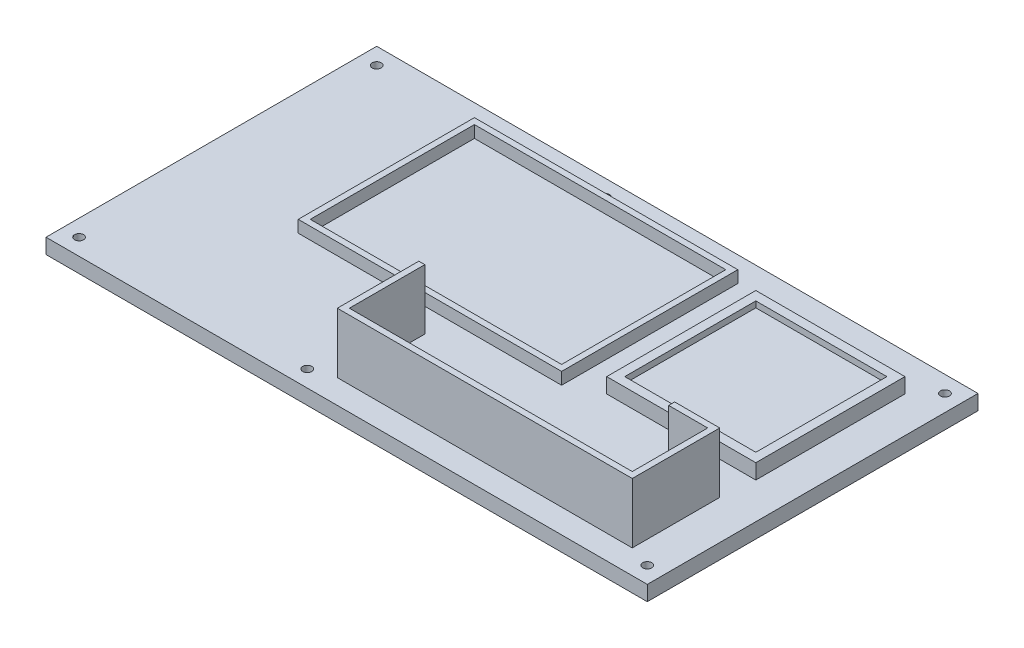
from build123d import *

# Parameters (mm, degrees)
SKETCH1_W           = 200
SKETCH1_H           = 110
BOSS_EXTRUDE1_DEPTH = 5
SKETCH4_R           = 1.5
CUT_EXTRUDE1_DEPTH  = 10
BOSS_EXTRUDE2_DEPTH = 20
SKETCH7_W           = 43.6
SKETCH7_H           = 43.6
BOSS_EXTRUDE3_DEPTH = 3
SKETCH7_3_W         = 49.6
SKETCH7_3_H         = 49.6
SKETCH7_3_W_2       = 43.6
SKETCH7_3_H_2       = 43.6
BOSS_EXTRUDE4_DEPTH = 5
SKETCH8_W           = 87.6
SKETCH8_H           = 58.6
SKETCH8_W_2         = 83.6
SKETCH8_H_2         = 54.6
BOSS_EXTRUDE5_DEPTH = 4
SKETCH9_R           = 1.5
CUT_EXTRUDE2_DEPTH  = 5


with BuildPart() as part:
    # Sketch1 → Boss-Extrude1 (new body)
    with BuildSketch(Plane(origin=(0, 0, 0), x_dir=(1, 0, 0), z_dir=(0, 1, 0))):
        Rectangle(SKETCH1_W, SKETCH1_H)
    extrude(amount=BOSS_EXTRUDE1_DEPTH)

    # Sketch4 → Cut-Extrude1 (cut)
    with BuildSketch(Plane(origin=(0, 5, 0), x_dir=(1, 0, 0), z_dir=(0, 1, 0))):
        with Locations((94.5, 49.5)):
            Circle(SKETCH4_R)
        with Locations((-94.5, 49.5)):
            Circle(SKETCH4_R)
        with Locations((-94.5, -49.5)):
            Circle(SKETCH4_R)
        with Locations((94.5, -49.5)):
            Circle(SKETCH4_R)
    extrude(amount=-CUT_EXTRUDE1_DEPTH, mode=Mode.SUBTRACT)

    # Sketch5 → Boss-Extrude2 (add)
    with BuildSketch(Plane(origin=(0, 5, 0), x_dir=(1, 0, 0), z_dir=(0, 1, 0))):
        Polygon((85, -19.9), (85, -45), (-9.1, -45), (-9.1, -19.9), (-11.1, -19.9), (-11.1, -47), (87, -47), (87, -17.9), (72, -17.9), (72, -19.9), align=None)
    extrude(amount=BOSS_EXTRUDE2_DEPTH)

    # Sketch7 → Boss-Extrude3 (add)
    with BuildSketch(Plane(origin=(0, 5, 0), x_dir=(1, 0, 0), z_dir=(0, 1, 0))):
        with Locations((63.2, 17.9)):
            Rectangle(SKETCH7_W, SKETCH7_H)
    extrude(amount=BOSS_EXTRUDE3_DEPTH)

    # Sketch7<3> → Boss-Extrude4 (add)
    with BuildSketch(Plane(origin=(0, 5, 0), x_dir=(1, 0, 0), z_dir=(0, 1, 0))):
        with Locations((63.2, 17.9)):
            Rectangle(SKETCH7_3_W, SKETCH7_3_H)
        with Locations((63.2, 17.9)):
            Rectangle(SKETCH7_3_W_2, SKETCH7_3_H_2, mode=Mode.SUBTRACT)
    extrude(amount=BOSS_EXTRUDE4_DEPTH)

    # Sketch8 → Boss-Extrude5 (add)
    with BuildSketch(Plane(origin=(0, 5, 0), x_dir=(1, 0, 0), z_dir=(0, 1, 0))):
        with Locations((-15.4, 17.4)):
            Rectangle(SKETCH8_W, SKETCH8_H)
        with Locations((-15.4, 17.4)):
            Rectangle(SKETCH8_W_2, SKETCH8_H_2, mode=Mode.SUBTRACT)
    extrude(amount=BOSS_EXTRUDE5_DEPTH)

    # Sketch9 → Cut-Extrude2 (cut)
    with BuildSketch(Plane(origin=(0, 5, 0), x_dir=(1, 0, 0), z_dir=(0, 1, 0))):
        with Locations((-18.6, -49.5)):
            Circle(SKETCH9_R)
        with Locations((-18.6, 49.5)):
            Circle(SKETCH9_R)
    extrude(amount=-CUT_EXTRUDE2_DEPTH, mode=Mode.SUBTRACT)


solid = part.part
